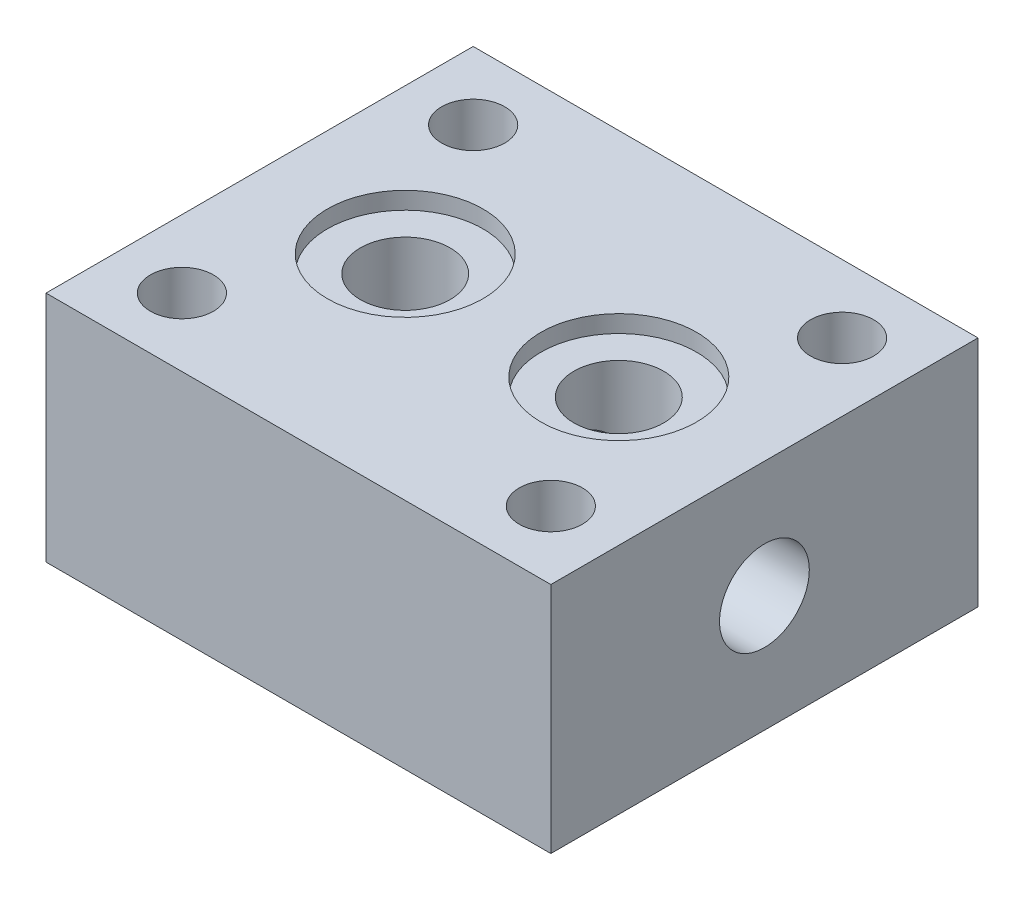
from build123d import *

# Parameters (mm, degrees)
SKETCH1_W           = 82.55
SKETCH1_H           = 69.85
BOSS_EXTRUDE1_DEPTH = 19.05
CUT_EXTRUDE2_START  = 19.05
SKETCH2_R           = 5.159375
CUT_EXTRUDE2_DEPTH  = 77.376117521
CUT_EXTRUDE4_START  = 19.05
SKETCH3_R           = 7.3421875
CUT_EXTRUDE4_DEPTH  = 28.575
CUT_EXTRUDE6_START  = 19.05
SKETCH4_R           = 12.7254
CUT_EXTRUDE6_DEPTH  = 2.8194
CUT_EXTRUDE8_START  = 41.275
SKETCH5_R           = 7.3421875
CUT_EXTRUDE8_DEPTH  = 60.325


with BuildPart() as part:
    # Sketch1 → Boss-Extrude1 (new, symmetric)
    with BuildSketch(Plane(origin=(0, 0, 0), x_dir=(1, 0, 0), z_dir=(0, 1, 0))):
        Rectangle(SKETCH1_W, SKETCH1_H)
    extrude(amount=BOSS_EXTRUDE1_DEPTH, both=True)

    # Sketch2 → Cut-Extrude2 (cut, through all)
    with BuildSketch(Plane(origin=(0, 0, 0), x_dir=(1, 0, 0), z_dir=(0, 1, 0)).offset(CUT_EXTRUDE2_START)):
        with Locations(Location((-30.1625, -23.8125, 0), (0, 0, 270))):
            Circle(SKETCH2_R)
        with Locations(Location((30.1625, -23.8125, 0), (0, 0, 270))):
            Circle(SKETCH2_R)
        with Locations(Location((-30.1625, 23.8125, 0), (0, 0, 270))):
            Circle(SKETCH2_R)
        with Locations(Location((30.1625, 23.8125, 0), (0, 0, 270))):
            Circle(SKETCH2_R)
    extrude(amount=-CUT_EXTRUDE2_DEPTH, mode=Mode.SUBTRACT)

    # Sketch3 → Cut-Extrude4 (cut)
    with BuildSketch(Plane(origin=(0, 0, 0), x_dir=(1, 0, 0), z_dir=(0, 1, 0)).offset(CUT_EXTRUDE4_START)):
        with Locations(Location((-17.4625, 0, 0), (0, 0, 270))):
            Circle(SKETCH3_R)
        with Locations(Location((17.4625, 0, 0), (0, 0, 270))):
            Circle(SKETCH3_R)
    extrude(amount=-CUT_EXTRUDE4_DEPTH, mode=Mode.SUBTRACT)

    # Sketch4 → Cut-Extrude6 (cut)
    with BuildSketch(Plane(origin=(0, 0, 0), x_dir=(1, 0, 0), z_dir=(0, 1, 0)).offset(CUT_EXTRUDE6_START)):
        with Locations(Location((-17.4625, 0, 0), (0, 0, 270))):
            Circle(SKETCH4_R)
        with Locations(Location((17.4625, 0, 0), (0, 0, 270))):
            Circle(SKETCH4_R)
    extrude(amount=-CUT_EXTRUDE6_DEPTH, mode=Mode.SUBTRACT)

    # Sketch5 → Cut-Extrude8 (cut)
    with BuildSketch(Plane(origin=(0, 0, 0), x_dir=(0, 0, -1), z_dir=(1, 0, 0)).offset(CUT_EXTRUDE8_START)):
        Circle(SKETCH5_R)
    extrude(amount=-CUT_EXTRUDE8_DEPTH, mode=Mode.SUBTRACT)


solid = part.part
